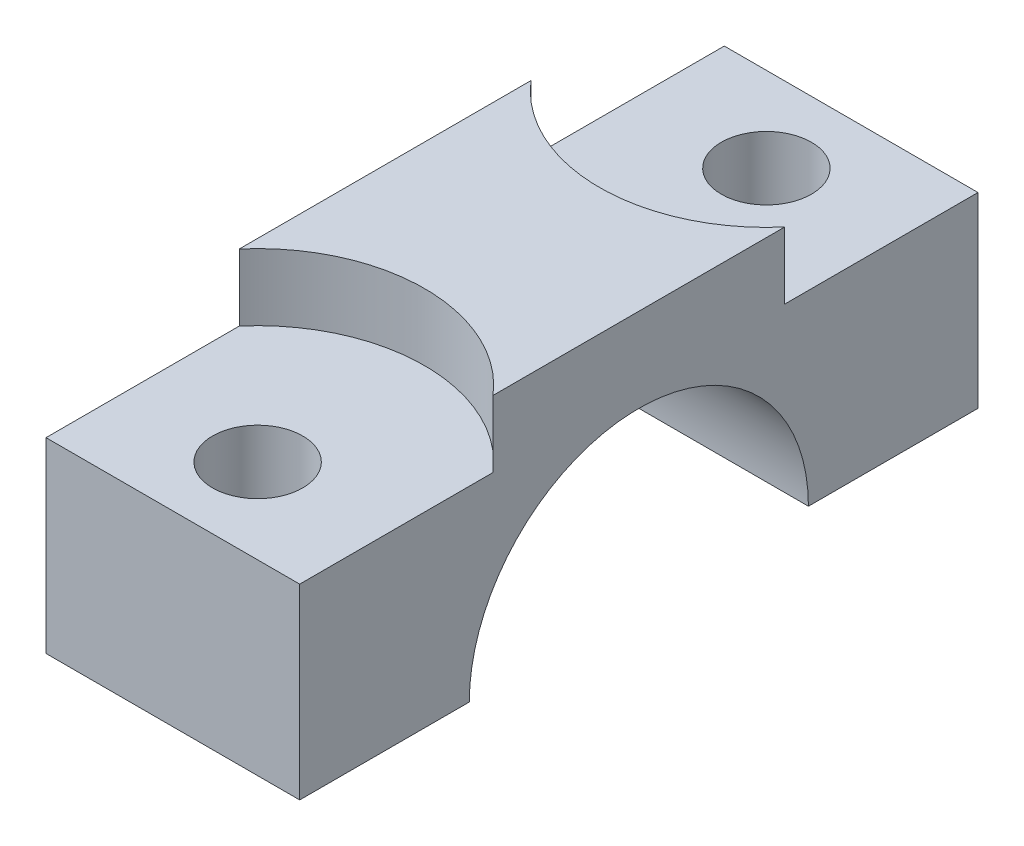
from build123d import *

# Parameters (mm, degrees)
BOSS_EXTRUDE1_DEPTH                           = 9.5
CBORE_FOR_M12_HEX_HEAD_CAP_SCREW3_D           = 6.75
CBORE_FOR_M12_HEX_HEAD_CAP_SCREW3_CBORE_D     = 25
CBORE_FOR_M12_HEX_HEAD_CAP_SCREW3_CBORE_DEPTH = 5


with BuildPart() as part:
    # Sketch1 → Boss-Extrude1 (new, symmetric)
    with BuildSketch(Plane(origin=(0, 0, 0), x_dir=(0, 0, -1), z_dir=(1, 0, 0))):
        with BuildLine():
            Line((25.4, 19), (-25.4, 19))
            Line((-25.4, 19), (-25.4, 0))
            Line((-25.4, 0), (-12.7, 0))
            ThreePointArc((-12.7, 0), (0, 12.7), (12.7, 0))
            Line((12.7, 0), (25.4, 0))
            Line((25.4, 0), (25.4, 19))
        make_face()
    extrude(amount=BOSS_EXTRUDE1_DEPTH, both=True)

    # CBORE for M12 Hex Head Cap Screw3 (through all)
    with Locations(Plane(origin=(0, 19, -19.05), x_dir=(0, 0, 1), z_dir=(0, 1, 0))):
        with Locations((0, 0), (38.1, 0)):
            CounterBoreHole(CBORE_FOR_M12_HEX_HEAD_CAP_SCREW3_D / 2, CBORE_FOR_M12_HEX_HEAD_CAP_SCREW3_CBORE_D / 2, CBORE_FOR_M12_HEX_HEAD_CAP_SCREW3_CBORE_DEPTH)


solid = part.part
